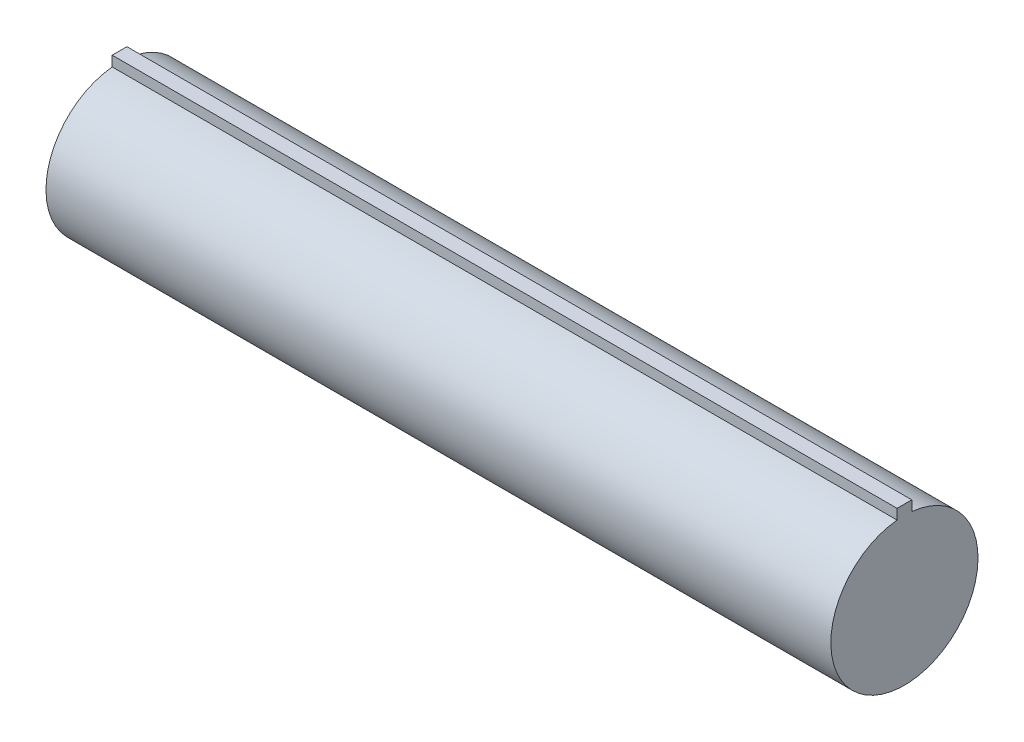
from build123d import *

# Parameters (mm, degrees)
EXTRUDE_START   = -80
EXTRUDE_1_DEPTH = 160


with BuildPart() as part:
    # 草图1 → 凸台-拉伸1 (new body)
    with BuildSketch(Plane(origin=(0, 0, 0), x_dir=(0, 0, -1), z_dir=(1, 0, 0)).offset(EXTRUDE_START)):
        with BuildLine():
            Line((-1.5, 14.924811557), (-1.5, 0))
            Line((-1.5, 0), (1.5, 0))
            Line((1.5, 0), (1.5, 14.924811557))
            ThreePointArc((1.5, 14.924811557), (0, 15), (-1.5, 14.924811557))
        make_face()
        with BuildLine():
            Line((1.5, 0), (-1.5, 0))
            Line((-1.5, 0), (-1.5, 14.924811557))
            ThreePointArc((-1.5, 14.924811557), (-10.062305899, -11.124297731), (15, 0))
            ThreePointArc((15, 0), (11.124297731, 10.062305899), (1.5, 14.924811557))
            Line((1.5, 14.924811557), (1.5, 0))
        make_face()
        with BuildLine():
            Line((-1.5, 17), (-1.5, 14.924811557))
            ThreePointArc((-1.5, 14.924811557), (0, 15), (1.5, 14.924811557))
            Line((1.5, 14.924811557), (1.5, 17))
            Line((1.5, 17), (-1.5, 17))
        make_face()
    extrude(amount=EXTRUDE_1_DEPTH)


solid = part.part
